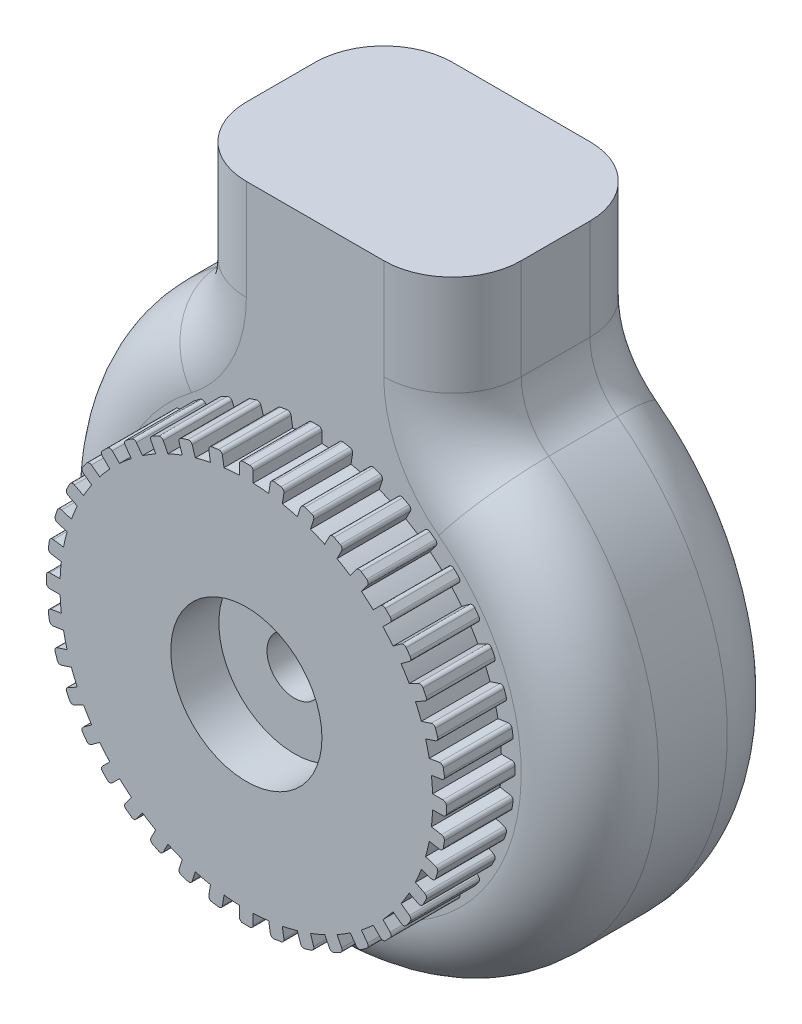
from build123d import *

# Parameters (mm, degrees)
BOSS_EXTRU_1_DEPTH      = 15
BOSS_EXTRU_1_DEPTH_BACK = 15
ESQUISSE3_R             = 15
BOSS_EXTRU_2_DEPTH      = 10
BOSS_EXTRU_3_DEPTH      = 10
ENL_V_MAT_EXTRU_1_REACH = 86.176
ESQUISSE5_R             = 4
ESQUISSE6_R             = 11
ENL_V_MAT_EXTRU_2_DEPTH = 7
ENL_V_START             = -7
ESQUISSE7_R             = 11
ENL_V_MAT_EXTRU_3_DEPTH = 7
CONG_2_R                = 10


with BuildPart() as part:
    # Esquisse1 → Boss.-Extru.1 (new, two sides: drawn at the far end of the back side and taken through both)
    with BuildSketch(Plane.XY.offset(-BOSS_EXTRU_1_DEPTH_BACK)):
        with BuildLine():
            ThreePointArc((-20, 34.641016151), (0, -40), (20, 34.641016151))
            Line((20, 34.641016151), (20, 54.641016151))
            Line((20, 54.641016151), (-20, 54.641016151))
            Line((-20, 54.641016151), (-20, 34.641016151))
        make_face()
    extrude(amount=BOSS_EXTRU_1_DEPTH + BOSS_EXTRU_1_DEPTH_BACK)

    # Esquisse3 → Boss.-Extru.2 (add)
    with BuildSketch(Plane(origin=(0, 0, -15), x_dir=(-1, 0, 0), z_dir=(0, 0, -1))):
        Circle(ESQUISSE3_R)
    extrude(amount=BOSS_EXTRU_2_DEPTH)

    # Esquisse4 → Boss.-Extru.3 (add)
    with BuildSketch(Plane.XY.offset(15)):
        with BuildLine():
            Line((-1, 27.100451988), (-1, 28.600451988))
            ThreePointArc((-1, 28.600451988), (-0.853553391, 28.954005378), (-0.5, 29.100451988))
            Line((-0.5, 29.100451988), (0.5, 29.100451988))
            ThreePointArc((0.5, 29.100451988), (0.853553391, 28.954005378), (1, 28.600451988))
            Line((1, 28.600451988), (1, 27.100451988))
            ThreePointArc((1, 27.100451988), (2.127724025, 27.035297084), (3.251756368, 26.923234918))
            Line((3.251756368, 26.923234918), (3.486408066, 28.404767429))
            ThreePointArc((3.486408066, 28.404767429), (3.68635961, 28.731058694), (4.058469469, 28.820394367))
            Line((4.058469469, 28.820394367), (5.046157809, 28.663959902))
            ThreePointArc((5.046157809, 28.663959902), (5.372449074, 28.464008357), (5.461784747, 28.091898499))
            Line((5.461784747, 28.091898499), (5.22713305, 26.610365988))
            ThreePointArc((5.22713305, 26.610365988), (6.330780448, 26.369598344), (7.423443703, 26.083078452))
            Line((7.423443703, 26.083078452), (7.886969195, 27.509663226))
            ThreePointArc((7.886969195, 27.509663226), (8.135502203, 27.800657991), (8.51700595, 27.830682987))
            Line((8.51700595, 27.830682987), (9.468062466, 27.521665993))
            ThreePointArc((9.468062466, 27.521665993), (9.759057231, 27.273132984), (9.789082227, 26.891629237))
            Line((9.789082227, 26.891629237), (9.325556736, 25.465044463))
            ThreePointArc((9.325556736, 25.465044463), (10.377952046, 25.054592578), (11.412341217, 24.600670029))
            Line((11.412341217, 24.600670029), (12.093326966, 25.937179815))
            ThreePointArc((12.093326966, 25.937179815), (12.384321731, 26.185712824), (12.765825478, 26.155687828))
            Line((12.765825478, 26.155687828), (13.656832003, 25.701697328))
            ThreePointArc((13.656832003, 25.701697328), (13.905365011, 25.410702563), (13.875340015, 25.029198816))
            Line((13.875340015, 25.029198816), (13.194354265, 23.69268903))
            ThreePointArc((13.194354265, 23.69268903), (14.169584022, 23.122659592), (15.120229014, 22.512511465))
            Line((15.120229014, 22.512511465), (16.001906893, 23.726036957))
            ThreePointArc((16.001906893, 23.726036957), (16.328198157, 23.925988501), (16.700308016, 23.836652828))
            Line((16.700308016, 23.836652828), (17.509325011, 23.248867576))
            ThreePointArc((17.509325011, 23.248867576), (17.709276555, 22.922576311), (17.619940882, 22.550466452))
            Line((17.619940882, 22.550466452), (16.738263003, 21.336940961))
            ThreePointArc((16.738263003, 21.336940961), (17.612313813, 20.621369986), (18.455806592, 19.870020155))
            Line((18.455806592, 19.870020155), (19.516466764, 20.930680327))
            ThreePointArc((19.516466764, 20.930680327), (19.870020155, 21.077126936), (20.223573545, 20.930680327))
            Line((20.223573545, 20.930680327), (20.930680327, 20.223573545))
            ThreePointArc((20.930680327, 20.223573545), (21.077126936, 19.870020155), (20.930680327, 19.516466764))
            Line((20.930680327, 19.516466764), (19.870020155, 18.455806592))
            ThreePointArc((19.870020155, 18.455806592), (20.621369986, 17.612313813), (21.336940961, 16.738263003))
            Line((21.336940961, 16.738263003), (22.550466452, 17.619940882))
            ThreePointArc((22.550466452, 17.619940882), (22.922576311, 17.709276555), (23.248867576, 17.509325011))
            Line((23.248867576, 17.509325011), (23.836652828, 16.700308016))
            ThreePointArc((23.836652828, 16.700308016), (23.925988501, 16.328198157), (23.726036957, 16.001906893))
            Line((23.726036957, 16.001906893), (22.512511465, 15.120229014))
            ThreePointArc((22.512511465, 15.120229014), (23.122659592, 14.169584022), (23.69268903, 13.194354265))
            Line((23.69268903, 13.194354265), (25.029198816, 13.875340015))
            ThreePointArc((25.029198816, 13.875340015), (25.410702563, 13.905365011), (25.701697328, 13.656832003))
            Line((25.701697328, 13.656832003), (26.155687828, 12.765825478))
            ThreePointArc((26.155687828, 12.765825478), (26.185712824, 12.384321731), (25.937179815, 12.093326966))
            Line((25.937179815, 12.093326966), (24.600670029, 11.412341217))
            ThreePointArc((24.600670029, 11.412341217), (25.054592578, 10.377952046), (25.465044463, 9.325556736))
            Line((25.465044463, 9.325556736), (26.891629237, 9.789082227))
            ThreePointArc((26.891629237, 9.789082227), (27.273132984, 9.759057231), (27.521665993, 9.468062466))
            Line((27.521665993, 9.468062466), (27.830682987, 8.51700595))
            ThreePointArc((27.830682987, 8.51700595), (27.800657991, 8.135502203), (27.509663226, 7.886969195))
            Line((27.509663226, 7.886969195), (26.083078452, 7.423443703))
            ThreePointArc((26.083078452, 7.423443703), (26.369598344, 6.330780448), (26.610365988, 5.22713305))
            Line((26.610365988, 5.22713305), (28.091898499, 5.461784747))
            ThreePointArc((28.091898499, 5.461784747), (28.464008357, 5.372449074), (28.663959902, 5.046157809))
            Line((28.663959902, 5.046157809), (28.820394367, 4.058469469))
            ThreePointArc((28.820394367, 4.058469469), (28.731058694, 3.68635961), (28.404767429, 3.486408066))
            Line((28.404767429, 3.486408066), (26.923234918, 3.251756368))
            ThreePointArc((26.923234918, 3.251756368), (27.035297084, 2.127724025), (27.100451988, 1))
            Line((27.100451988, 1), (28.600451988, 1))
            ThreePointArc((28.600451988, 1), (28.954005378, 0.853553391), (29.100451988, 0.5))
            Line((29.100451988, 0.5), (29.100451988, -0.5))
            ThreePointArc((29.100451988, -0.5), (28.954005378, -0.853553391), (28.600451988, -1))
            Line((28.600451988, -1), (27.100451988, -1))
            ThreePointArc((27.100451988, -1), (27.035297084, -2.127724025), (26.923234918, -3.251756368))
            Line((26.923234918, -3.251756368), (28.404767429, -3.486408066))
            ThreePointArc((28.404767429, -3.486408066), (28.731058694, -3.68635961), (28.820394367, -4.058469469))
            Line((28.820394367, -4.058469469), (28.663959902, -5.046157809))
            ThreePointArc((28.663959902, -5.046157809), (28.464008357, -5.372449074), (28.091898499, -5.461784747))
            Line((28.091898499, -5.461784747), (26.610365988, -5.22713305))
            ThreePointArc((26.610365988, -5.22713305), (26.369598344, -6.330780448), (26.083078452, -7.423443703))
            Line((26.083078452, -7.423443703), (27.509663226, -7.886969195))
            ThreePointArc((27.509663226, -7.886969195), (27.800657991, -8.135502203), (27.830682987, -8.51700595))
            Line((27.830682987, -8.51700595), (27.521665993, -9.468062466))
            ThreePointArc((27.521665993, -9.468062466), (27.273132984, -9.759057231), (26.891629237, -9.789082227))
            Line((26.891629237, -9.789082227), (25.465044463, -9.325556736))
            ThreePointArc((25.465044463, -9.325556736), (25.054592578, -10.377952046), (24.600670029, -11.412341217))
            Line((24.600670029, -11.412341217), (25.937179815, -12.093326966))
            ThreePointArc((25.937179815, -12.093326966), (26.185712824, -12.384321731), (26.155687828, -12.765825478))
            Line((26.155687828, -12.765825478), (25.701697328, -13.656832003))
            ThreePointArc((25.701697328, -13.656832003), (25.410702563, -13.905365011), (25.029198816, -13.875340015))
            Line((25.029198816, -13.875340015), (23.69268903, -13.194354265))
            ThreePointArc((23.69268903, -13.194354265), (23.122659592, -14.169584022), (22.512511465, -15.120229014))
            Line((22.512511465, -15.120229014), (23.726036957, -16.001906893))
            ThreePointArc((23.726036957, -16.001906893), (23.925988501, -16.328198157), (23.836652828, -16.700308016))
            Line((23.836652828, -16.700308016), (23.248867576, -17.509325011))
            ThreePointArc((23.248867576, -17.509325011), (22.922576311, -17.709276555), (22.550466452, -17.619940882))
            Line((22.550466452, -17.619940882), (21.336940961, -16.738263003))
            ThreePointArc((21.336940961, -16.738263003), (20.621369986, -17.612313813), (19.870020155, -18.455806592))
            Line((19.870020155, -18.455806592), (20.930680327, -19.516466764))
            ThreePointArc((20.930680327, -19.516466764), (21.077126936, -19.870020155), (20.930680327, -20.223573545))
            Line((20.930680327, -20.223573545), (20.223573545, -20.930680327))
            ThreePointArc((20.223573545, -20.930680327), (19.870020155, -21.077126936), (19.516466764, -20.930680327))
            Line((19.516466764, -20.930680327), (18.455806592, -19.870020155))
            ThreePointArc((18.455806592, -19.870020155), (17.612313813, -20.621369986), (16.738263003, -21.336940961))
            Line((16.738263003, -21.336940961), (17.619940882, -22.550466452))
            ThreePointArc((17.619940882, -22.550466452), (17.709276555, -22.922576311), (17.509325011, -23.248867576))
            Line((17.509325011, -23.248867576), (16.700308016, -23.836652828))
            ThreePointArc((16.700308016, -23.836652828), (16.328198157, -23.925988501), (16.001906893, -23.726036957))
            Line((16.001906893, -23.726036957), (15.120229014, -22.512511465))
            ThreePointArc((15.120229014, -22.512511465), (14.169584022, -23.122659592), (13.194354265, -23.69268903))
            Line((13.194354265, -23.69268903), (13.875340015, -25.029198816))
            ThreePointArc((13.875340015, -25.029198816), (13.905365011, -25.410702563), (13.656832003, -25.701697328))
            Line((13.656832003, -25.701697328), (12.765825478, -26.155687828))
            ThreePointArc((12.765825478, -26.155687828), (12.384321731, -26.185712824), (12.093326966, -25.937179815))
            Line((12.093326966, -25.937179815), (11.412341217, -24.600670029))
            ThreePointArc((11.412341217, -24.600670029), (10.377952046, -25.054592578), (9.325556736, -25.465044463))
            Line((9.325556736, -25.465044463), (9.789082227, -26.891629237))
            ThreePointArc((9.789082227, -26.891629237), (9.759057231, -27.273132984), (9.468062466, -27.521665993))
            Line((9.468062466, -27.521665993), (8.51700595, -27.830682987))
            ThreePointArc((8.51700595, -27.830682987), (8.135502203, -27.800657991), (7.886969195, -27.509663226))
            Line((7.886969195, -27.509663226), (7.423443703, -26.083078452))
            ThreePointArc((7.423443703, -26.083078452), (6.330780448, -26.369598344), (5.22713305, -26.610365988))
            Line((5.22713305, -26.610365988), (5.461784747, -28.091898499))
            ThreePointArc((5.461784747, -28.091898499), (5.372449074, -28.464008357), (5.046157809, -28.663959902))
            Line((5.046157809, -28.663959902), (4.058469469, -28.820394367))
            ThreePointArc((4.058469469, -28.820394367), (3.68635961, -28.731058694), (3.486408066, -28.404767429))
            Line((3.486408066, -28.404767429), (3.251756368, -26.923234918))
            ThreePointArc((3.251756368, -26.923234918), (2.127724025, -27.035297084), (1, -27.100451988))
            Line((1, -27.100451988), (1, -28.600451988))
            ThreePointArc((1, -28.600451988), (0.853553391, -28.954005378), (0.5, -29.100451988))
            Line((0.5, -29.100451988), (-0.5, -29.100451988))
            ThreePointArc((-0.5, -29.100451988), (-0.853553391, -28.954005378), (-1, -28.600451988))
            Line((-1, -28.600451988), (-1, -27.100451988))
            ThreePointArc((-1, -27.100451988), (-2.127724025, -27.035297084), (-3.251756368, -26.923234918))
            Line((-3.251756368, -26.923234918), (-3.486408066, -28.404767429))
            ThreePointArc((-3.486408066, -28.404767429), (-3.68635961, -28.731058694), (-4.058469469, -28.820394367))
            Line((-4.058469469, -28.820394367), (-5.046157809, -28.663959902))
            ThreePointArc((-5.046157809, -28.663959902), (-5.372449074, -28.464008357), (-5.461784747, -28.091898499))
            Line((-5.461784747, -28.091898499), (-5.22713305, -26.610365988))
            ThreePointArc((-5.22713305, -26.610365988), (-6.330780448, -26.369598344), (-7.423443703, -26.083078452))
            Line((-7.423443703, -26.083078452), (-7.886969195, -27.509663226))
            ThreePointArc((-7.886969195, -27.509663226), (-8.135502203, -27.800657991), (-8.51700595, -27.830682987))
            Line((-8.51700595, -27.830682987), (-9.468062466, -27.521665993))
            ThreePointArc((-9.468062466, -27.521665993), (-9.759057231, -27.273132984), (-9.789082227, -26.891629237))
            Line((-9.789082227, -26.891629237), (-9.325556736, -25.465044463))
            ThreePointArc((-9.325556736, -25.465044463), (-10.377952046, -25.054592578), (-11.412341217, -24.600670029))
            Line((-11.412341217, -24.600670029), (-12.093326966, -25.937179815))
            ThreePointArc((-12.093326966, -25.937179815), (-12.384321731, -26.185712824), (-12.765825478, -26.155687828))
            Line((-12.765825478, -26.155687828), (-13.656832003, -25.701697328))
            ThreePointArc((-13.656832003, -25.701697328), (-13.905365011, -25.410702563), (-13.875340015, -25.029198816))
            Line((-13.875340015, -25.029198816), (-13.194354265, -23.69268903))
            ThreePointArc((-13.194354265, -23.69268903), (-14.169584022, -23.122659592), (-15.120229014, -22.512511465))
            Line((-15.120229014, -22.512511465), (-16.001906893, -23.726036957))
            ThreePointArc((-16.001906893, -23.726036957), (-16.328198157, -23.925988501), (-16.700308016, -23.836652828))
            Line((-16.700308016, -23.836652828), (-17.509325011, -23.248867576))
            ThreePointArc((-17.509325011, -23.248867576), (-17.709276555, -22.922576311), (-17.619940882, -22.550466452))
            Line((-17.619940882, -22.550466452), (-16.738263003, -21.336940961))
            ThreePointArc((-16.738263003, -21.336940961), (-17.612313813, -20.621369986), (-18.455806592, -19.870020155))
            Line((-18.455806592, -19.870020155), (-19.516466764, -20.930680327))
            ThreePointArc((-19.516466764, -20.930680327), (-19.870020155, -21.077126936), (-20.223573545, -20.930680327))
            Line((-20.223573545, -20.930680327), (-20.930680327, -20.223573545))
            ThreePointArc((-20.930680327, -20.223573545), (-21.077126936, -19.870020155), (-20.930680327, -19.516466764))
            Line((-20.930680327, -19.516466764), (-19.870020155, -18.455806592))
            ThreePointArc((-19.870020155, -18.455806592), (-20.621369986, -17.612313813), (-21.336940961, -16.738263003))
            Line((-21.336940961, -16.738263003), (-22.550466452, -17.619940882))
            ThreePointArc((-22.550466452, -17.619940882), (-22.922576311, -17.709276555), (-23.248867576, -17.509325011))
            Line((-23.248867576, -17.509325011), (-23.836652828, -16.700308016))
            ThreePointArc((-23.836652828, -16.700308016), (-23.925988501, -16.328198157), (-23.726036957, -16.001906893))
            Line((-23.726036957, -16.001906893), (-22.512511465, -15.120229014))
            ThreePointArc((-22.512511465, -15.120229014), (-23.122659592, -14.169584022), (-23.69268903, -13.194354265))
            Line((-23.69268903, -13.194354265), (-25.029198816, -13.875340015))
            ThreePointArc((-25.029198816, -13.875340015), (-25.410702563, -13.905365011), (-25.701697328, -13.656832003))
            Line((-25.701697328, -13.656832003), (-26.155687828, -12.765825478))
            ThreePointArc((-26.155687828, -12.765825478), (-26.185712824, -12.384321731), (-25.937179815, -12.093326966))
            Line((-25.937179815, -12.093326966), (-24.600670029, -11.412341217))
            ThreePointArc((-24.600670029, -11.412341217), (-25.054592578, -10.377952046), (-25.465044463, -9.325556736))
            Line((-25.465044463, -9.325556736), (-26.891629237, -9.789082227))
            ThreePointArc((-26.891629237, -9.789082227), (-27.273132984, -9.759057231), (-27.521665993, -9.468062466))
            Line((-27.521665993, -9.468062466), (-27.830682987, -8.51700595))
            ThreePointArc((-27.830682987, -8.51700595), (-27.800657991, -8.135502203), (-27.509663226, -7.886969195))
            Line((-27.509663226, -7.886969195), (-26.083078452, -7.423443703))
            ThreePointArc((-26.083078452, -7.423443703), (-26.369598344, -6.330780448), (-26.610365988, -5.22713305))
            Line((-26.610365988, -5.22713305), (-28.091898499, -5.461784747))
            ThreePointArc((-28.091898499, -5.461784747), (-28.464008357, -5.372449074), (-28.663959902, -5.046157809))
            Line((-28.663959902, -5.046157809), (-28.820394367, -4.058469469))
            ThreePointArc((-28.820394367, -4.058469469), (-28.731058694, -3.68635961), (-28.404767429, -3.486408066))
            Line((-28.404767429, -3.486408066), (-26.923234918, -3.251756368))
            ThreePointArc((-26.923234918, -3.251756368), (-27.035297084, -2.127724025), (-27.100451988, -1))
            Line((-27.100451988, -1), (-28.600451988, -1))
            ThreePointArc((-28.600451988, -1), (-28.954005378, -0.853553391), (-29.100451988, -0.5))
            Line((-29.100451988, -0.5), (-29.100451988, 0.5))
            ThreePointArc((-29.100451988, 0.5), (-28.954005378, 0.853553391), (-28.600451988, 1))
            Line((-28.600451988, 1), (-27.100451988, 1))
            ThreePointArc((-27.100451988, 1), (-27.035297084, 2.127724025), (-26.923234918, 3.251756368))
            Line((-26.923234918, 3.251756368), (-28.404767429, 3.486408066))
            ThreePointArc((-28.404767429, 3.486408066), (-28.731058694, 3.68635961), (-28.820394367, 4.058469469))
            Line((-28.820394367, 4.058469469), (-28.663959902, 5.046157809))
            ThreePointArc((-28.663959902, 5.046157809), (-28.464008357, 5.372449074), (-28.091898499, 5.461784747))
            Line((-28.091898499, 5.461784747), (-26.610365988, 5.22713305))
            ThreePointArc((-26.610365988, 5.22713305), (-26.369598344, 6.330780448), (-26.083078452, 7.423443703))
            Line((-26.083078452, 7.423443703), (-27.509663226, 7.886969195))
            ThreePointArc((-27.509663226, 7.886969195), (-27.800657991, 8.135502203), (-27.830682987, 8.51700595))
            Line((-27.830682987, 8.51700595), (-27.521665993, 9.468062466))
            ThreePointArc((-27.521665993, 9.468062466), (-27.273132984, 9.759057231), (-26.891629237, 9.789082227))
            Line((-26.891629237, 9.789082227), (-25.465044463, 9.325556736))
            ThreePointArc((-25.465044463, 9.325556736), (-25.054592578, 10.377952046), (-24.600670029, 11.412341217))
            Line((-24.600670029, 11.412341217), (-25.937179815, 12.093326966))
            ThreePointArc((-25.937179815, 12.093326966), (-26.185712824, 12.384321731), (-26.155687828, 12.765825478))
            Line((-26.155687828, 12.765825478), (-25.701697328, 13.656832003))
            ThreePointArc((-25.701697328, 13.656832003), (-25.410702563, 13.905365011), (-25.029198816, 13.875340015))
            Line((-25.029198816, 13.875340015), (-23.69268903, 13.194354265))
            ThreePointArc((-23.69268903, 13.194354265), (-23.122659592, 14.169584022), (-22.512511465, 15.120229014))
            Line((-22.512511465, 15.120229014), (-23.726036957, 16.001906893))
            ThreePointArc((-23.726036957, 16.001906893), (-23.925988501, 16.328198157), (-23.836652828, 16.700308016))
            Line((-23.836652828, 16.700308016), (-23.248867576, 17.509325011))
            ThreePointArc((-23.248867576, 17.509325011), (-22.922576311, 17.709276555), (-22.550466452, 17.619940882))
            Line((-22.550466452, 17.619940882), (-21.336940961, 16.738263003))
            ThreePointArc((-21.336940961, 16.738263003), (-20.621369986, 17.612313813), (-19.870020155, 18.455806592))
            Line((-19.870020155, 18.455806592), (-20.930680327, 19.516466764))
            ThreePointArc((-20.930680327, 19.516466764), (-21.077126936, 19.870020155), (-20.930680327, 20.223573545))
            Line((-20.930680327, 20.223573545), (-20.223573545, 20.930680327))
            ThreePointArc((-20.223573545, 20.930680327), (-19.870020155, 21.077126936), (-19.516466764, 20.930680327))
            Line((-19.516466764, 20.930680327), (-18.455806592, 19.870020155))
            ThreePointArc((-18.455806592, 19.870020155), (-17.612313813, 20.621369986), (-16.738263003, 21.336940961))
            Line((-16.738263003, 21.336940961), (-17.619940882, 22.550466452))
            ThreePointArc((-17.619940882, 22.550466452), (-17.709276555, 22.922576311), (-17.509325011, 23.248867576))
            Line((-17.509325011, 23.248867576), (-16.700308016, 23.836652828))
            ThreePointArc((-16.700308016, 23.836652828), (-16.328198157, 23.925988501), (-16.001906893, 23.726036957))
            Line((-16.001906893, 23.726036957), (-15.120229014, 22.512511465))
            ThreePointArc((-15.120229014, 22.512511465), (-14.169584022, 23.122659592), (-13.194354265, 23.69268903))
            Line((-13.194354265, 23.69268903), (-13.875340015, 25.029198816))
            ThreePointArc((-13.875340015, 25.029198816), (-13.905365011, 25.410702563), (-13.656832003, 25.701697328))
            Line((-13.656832003, 25.701697328), (-12.765825478, 26.155687828))
            ThreePointArc((-12.765825478, 26.155687828), (-12.384321731, 26.185712824), (-12.093326966, 25.937179815))
            Line((-12.093326966, 25.937179815), (-11.412341217, 24.600670029))
            ThreePointArc((-11.412341217, 24.600670029), (-10.377952046, 25.054592578), (-9.325556736, 25.465044463))
            Line((-9.325556736, 25.465044463), (-9.789082227, 26.891629237))
            ThreePointArc((-9.789082227, 26.891629237), (-9.759057231, 27.273132984), (-9.468062466, 27.521665993))
            Line((-9.468062466, 27.521665993), (-8.51700595, 27.830682987))
            ThreePointArc((-8.51700595, 27.830682987), (-8.135502203, 27.800657991), (-7.886969195, 27.509663226))
            Line((-7.886969195, 27.509663226), (-7.423443703, 26.083078452))
            ThreePointArc((-7.423443703, 26.083078452), (-6.330780448, 26.369598344), (-5.22713305, 26.610365988))
            Line((-5.22713305, 26.610365988), (-5.461784747, 28.091898499))
            ThreePointArc((-5.461784747, 28.091898499), (-5.372449074, 28.464008357), (-5.046157809, 28.663959902))
            Line((-5.046157809, 28.663959902), (-4.058469469, 28.820394367))
            ThreePointArc((-4.058469469, 28.820394367), (-3.68635961, 28.731058694), (-3.486408066, 28.404767429))
            Line((-3.486408066, 28.404767429), (-3.251756368, 26.923234918))
            ThreePointArc((-3.251756368, 26.923234918), (-2.127724025, 27.035297084), (-1, 27.100451988))
        make_face()
    extrude(amount=BOSS_EXTRU_3_DEPTH)

    # Esquisse5 → Enlèv. mat.-Extru.1 (cut, up to next)
    with BuildSketch(Plane.XY.offset(25), mode=Mode.PRIVATE) as enl_v_mat_extru_1_sk1:
        Circle(ESQUISSE5_R)
    enl_v_mat_extru_1_tool1 = extrude(enl_v_mat_extru_1_sk1.sketch, amount=-ENL_V_MAT_EXTRU_1_REACH, mode=Mode.PRIVATE) & part.part
    add(enl_v_mat_extru_1_tool1.solids().sort_by_distance((0, 0, 25))[0], mode=Mode.SUBTRACT)

    # Esquisse6 → Enlèv. mat.-Extru.2 (cut)
    with BuildSketch(Plane.XY.offset(25)):
        Circle(ESQUISSE6_R)
    extrude(amount=-ENL_V_MAT_EXTRU_2_DEPTH, mode=Mode.SUBTRACT)

    # Esquisse7 → Enlèv. mat.-Extru.3 (cut)
    with BuildSketch(Plane(origin=(0, 0, -25), x_dir=(-1, 0, 0), z_dir=(0, 0, -1)).offset(ENL_V_START)):
        Circle(ESQUISSE7_R)
    extrude(amount=ENL_V_MAT_EXTRU_3_DEPTH, mode=Mode.SUBTRACT)

    # Congé2
    cong_2_edges = [part.edges().sort_by_distance(p)[0] for p in [
        (-20, 44.641016151, -15),
        (20, 44.641016151, -15),
        (-20, 44.641016151, 15),
        (20, 44.641016151, 15),
        (0, -40, -15),
        (-20, 34.641016151, 0),
        (0, -40, 15),
        (20, 34.641016151, 0),
    ]]
    fillet(cong_2_edges, radius=CONG_2_R)


solid = part.part
